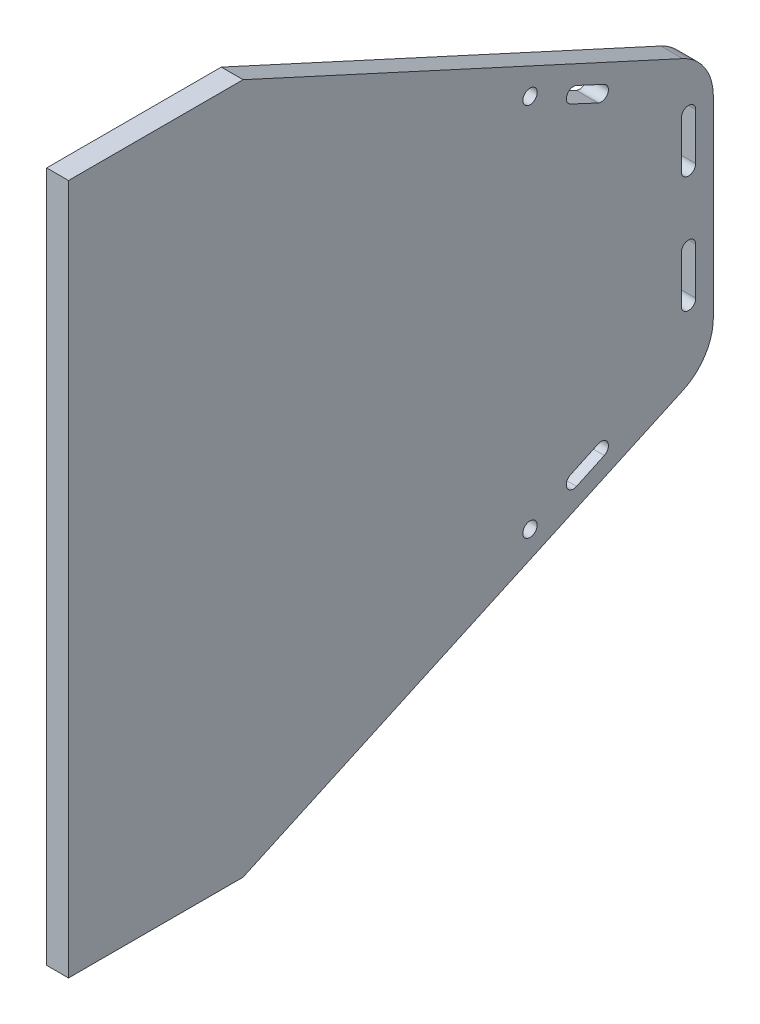
from build123d import *

# Parameters (mm, degrees)
BOSS_EXTRUDE1_DEPTH = 5
SKETCH4_R           = 1.65
CUT_EXTRUDE1_DEPTH  = 5


with BuildPart() as part:
    # Sketch1 → Boss-Extrude1 (new body)
    with BuildSketch(Plane(origin=(0, 0, 0), x_dir=(0, 0, -1), z_dir=(1, 0, 0))):
        with BuildLine():
            Line((-44.040507459, 114.890413128), (-44.040507459, -43.329586872))
            Line((-44.040507459, -43.329586872), (-4.040507459, -43.329586872))
            Line((-4.040507459, -43.329586872), (96.679252091, 2.847191371))
            ThreePointArc((96.679252091, 2.847191371), (101.778005077, 7.275167621), (103.678182397, 13.755413128))
            Line((103.678182397, 13.755413128), (103.678182397, 57.805413128))
            ThreePointArc((103.678182397, 57.805413128), (101.778005077, 64.285658635), (96.679252091, 68.713634886))
            Line((96.679252091, 68.713634886), (-4.040507459, 114.890413128))
            Line((-4.040507459, 114.890413128), (-44.040507459, 114.890413128))
        make_face()
    extrude(amount=BOSS_EXTRUDE1_DEPTH)

    # Sketch4 → Cut-Extrude1 (cut)
    with BuildSketch(Plane(origin=(5, 0, 0), x_dir=(0, 0, -1), z_dir=(1, 0, 0))):
        with Locations((61.684952492, -7.146090177)):
            Circle(SKETCH4_R)
        with Locations(Location((61.684952492, 78.706916433, 0), (0, 0, 180))):
            Circle(SKETCH4_R)
        with BuildLine():
            Line((99.647066235, 57.119488088), (99.647066235, 46.419488088))
            ThreePointArc((99.647066235, 46.419488088), (97.997066235, 44.769488088), (96.347066235, 46.419488088))
            Line((96.347066235, 46.419488088), (96.347066235, 57.119488088))
            ThreePointArc((96.347066235, 57.119488088), (97.997066235, 58.769488088), (99.647066235, 57.119488088))
        make_face()
        with BuildLine():
            Line((99.647066235, 30.419488088), (99.647066235, 19.719488088))
            ThreePointArc((99.647066235, 19.719488088), (97.997066235, 18.069488088), (96.347066235, 19.719488088))
            Line((96.347066235, 19.719488088), (96.347066235, 30.419488088))
            ThreePointArc((96.347066235, 30.419488088), (97.997066235, 32.069488088), (99.647066235, 30.419488088))
        make_face()
        with BuildLine():
            Line((70.955654901, -0.999824899), (77.299153047, 1.959910101))
            ThreePointArc((77.299153047, 1.959910101), (79.492058003, 1.162308788), (78.69445669, -1.030596168))
            Line((78.69445669, -1.030596168), (72.350958543, -3.990331168))
            ThreePointArc((72.350958543, -3.990331168), (70.158053588, -3.192729855), (70.955654901, -0.999824899))
        make_face()
        with BuildLine():
            Line((70.955654901, 72.560651156), (77.299153047, 69.600916156))
            ThreePointArc((77.299153047, 69.600916156), (79.492058003, 70.398517469), (78.69445669, 72.591422424))
            Line((78.69445669, 72.591422424), (72.350958543, 75.551157424))
            ThreePointArc((72.350958543, 75.551157424), (70.158053588, 74.753556111), (70.955654901, 72.560651156))
        make_face()
    extrude(amount=-CUT_EXTRUDE1_DEPTH, mode=Mode.SUBTRACT)


solid = part.part
